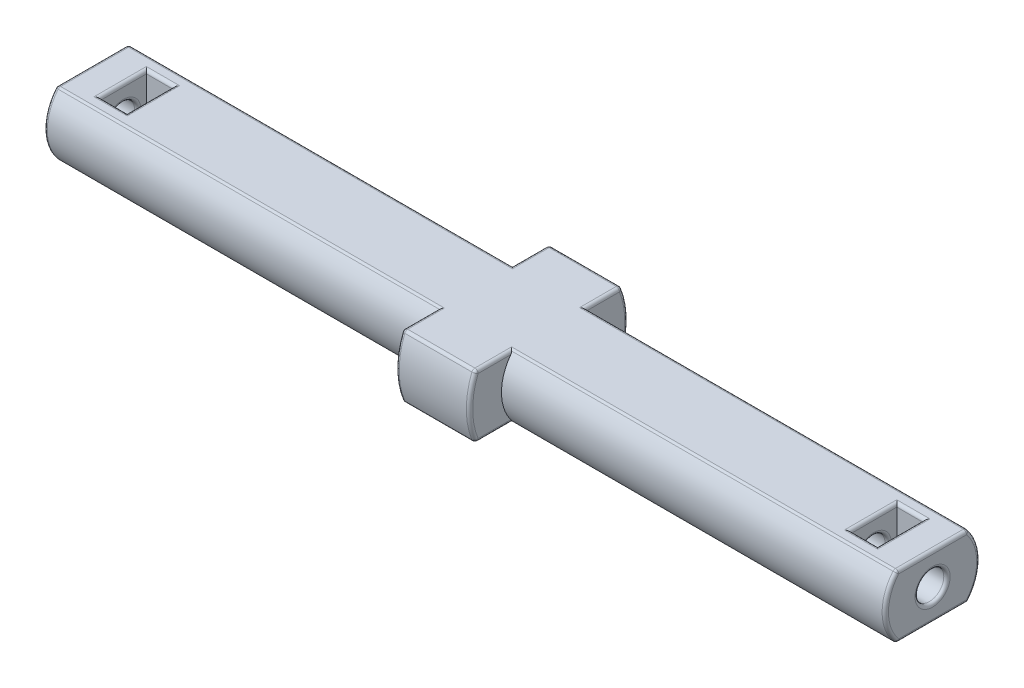
from build123d import *

# Parameters (mm, degrees)
CUT_EXTRUDE1_DEPTH      = 69.096695955
CUT_EXTRUDE1_DEPTH_BACK = 69.096695955
SKETCH2_W               = 131.6
SKETCH2_H               = 15.1
SKETCH3_R               = 2.25
CUT_EXTRUDE2_DEPTH      = 15
CUT_EXTRUDE3_START      = -15
SKETCH4_R               = 2.25
CUT_EXTRUDE3_DEPTH      = 15
CUT_EXTRUDE4_DEPTH      = 4.2
FILLET1_R               = 0.5


with BuildPart() as part:
    # Sketch1 → Revolve1 (revolve)
    with BuildSketch(Plane(origin=(0, 0, 0), x_dir=(1, 0, 0), z_dir=(0, 1, 0)), mode=Mode.PRIVATE) as revolve1_sk:
        Polygon((-65.8, 0), (-65.8, 7.4), (-5.75, 7.4), (-5.75, 12.4), (5.75, 12.4), (5.75, 7.4), (65.8, 7.4), (65.8, 0), align=None)
    revolve(revolve1_sk.sketch.rotate(Axis((-104.544352148, 0, 0), (1, 0, 0)), 180), axis=Axis((-104.544352148, 0, 0), (1, 0, 0)))

    # Sketch2 → Cut-Extrude1 (cut, two sides: drawn at the far end of the back side and taken through both)
    with BuildSketch(Plane.XY.offset(-CUT_EXTRUDE1_DEPTH_BACK)):
        with Locations((0, 12.45)):
            Rectangle(SKETCH2_W, SKETCH2_H)
        with Locations((0, -12.45)):
            Rectangle(SKETCH2_W, SKETCH2_H)
    extrude(amount=CUT_EXTRUDE1_DEPTH + CUT_EXTRUDE1_DEPTH_BACK, mode=Mode.SUBTRACT)

    # Sketch3 → Cut-Extrude2 (cut)
    with BuildSketch(Plane(origin=(65.8, 0, 0), x_dir=(0, 0, -1), z_dir=(1, 0, 0))):
        Circle(SKETCH3_R)
    extrude(amount=-CUT_EXTRUDE2_DEPTH, mode=Mode.SUBTRACT)

    # Sketch4 → Cut-Extrude3 (cut)
    with BuildSketch(Plane.ZY.offset(65.8).offset(CUT_EXTRUDE3_START)):
        with Locations(Location((0, 0, 0), (0, 0, 180))):
            Circle(SKETCH4_R)
    extrude(amount=CUT_EXTRUDE3_DEPTH, mode=Mode.SUBTRACT)

    # Sketch5 → Cut-Extrude4 (cut)
    with BuildSketch(Plane.ZY.offset(60.8)):
        Polygon((3.6, 4.9), (3.6, 2.078460969), (0, 4.156921938), (-3.6, 2.078460969), (-3.6, 4.9), align=None)
        Polygon((-3.6, 2.078460969), (-3.6, -2.078460969), (0, -4.156921938), (3.6, -2.078460969), (3.6, 2.078460969), (0, 4.156921938), align=None)
    cut_extrude4 = extrude(amount=-CUT_EXTRUDE4_DEPTH, mode=Mode.SUBTRACT)

    # Mirror1: Cut-Extrude4 across plane
    add(cut_extrude4.mirror(Plane(origin=(0, 0, 0), x_dir=(0, 0, 1), z_dir=(1, 0, 0))), mode=Mode.SUBTRACT)

    # Fillet1
    fillet1_edges = [part.edges().sort_by_distance(p)[0] for p in [
        (60.8, 4.9, 0),
        (60.8, 0, 2.25),
        (58.7, 4.9, -3.6),
        (56.6, 4.9, 0),
        (58.7, 4.9, 3.6),
        (56.6, 0, 2.25),
        (-5.75, 0, -12.4),
        (-5.75, 0, 12.4),
        (-5.75, -4.9, 8.468027002),
        (-5.75, -4.9, -8.468027002),
        (-5.75, 4.9, 8.468027002),
        (-5.75, 4.9, -8.468027002),
        (5.75, 0, -12.4),
        (5.75, 0, 12.4),
        (65.8, 0, -7.4),
        (65.8, 0, 7.4),
        (-65.8, 0, -7.4),
        (-65.8, 0, 7.4),
        (-65.8, 4.9, 0),
        (65.8, 4.9, 0),
        (-35.775, 4.9, -5.545268253),
        (35.775, 4.9, -5.545268253),
        (5.75, 4.9, -8.468027002),
        (0, 4.9, -11.39078575),
        (-35.775, 4.9, 5.545268253),
        (0, 4.9, 11.39078575),
        (5.75, 4.9, 8.468027002),
        (35.775, 4.9, 5.545268253),
        (65.8, -4.9, 0),
        (-35.775, -4.9, -5.545268253),
        (-65.8, -4.9, 0),
        (-35.775, -4.9, 5.545268253),
        (0, -4.9, 11.39078575),
        (5.75, -4.9, 8.468027002),
        (35.775, -4.9, 5.545268253),
        (35.775, -4.9, -5.545268253),
        (5.75, -4.9, -8.468027002),
        (0, -4.9, -11.39078575),
        (65.8, 0, 2.25),
        (-56.6, 4.9, 0),
        (-60.8, 0, 2.25),
        (-60.8, 4.9, 0),
        (-58.7, 4.9, -3.6),
        (-58.7, 4.9, 3.6),
        (-56.6, 0, 2.25),
    ]]
    fillet(fillet1_edges, radius=FILLET1_R)


solid = part.part
